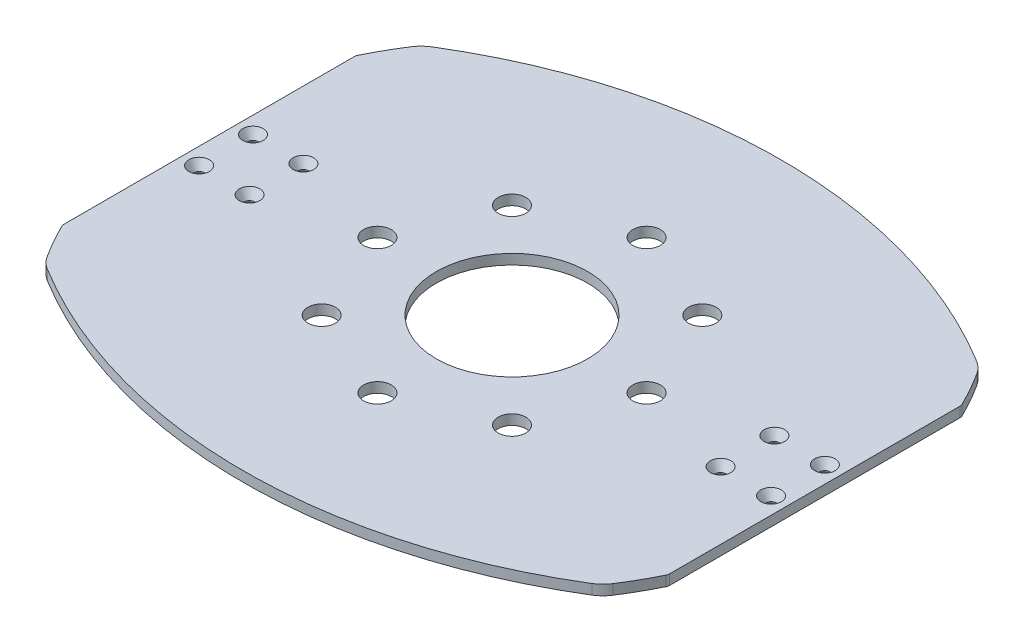
from build123d import *

# Parameters (mm, degrees)
SKETCH_2_W          = 180
SKETCH_2_H          = 180
EXTRUDE_1_DEPTH     = 3
SKETCH_3_R          = 4.1
CUT_EXTRUDE_1_DEPTH = 3
SKETCH_4_OUTSIDE_W  = 232.916
SKETCH_4_OUTSIDE_H  = 232.916
SKETCH_4_OUTSIDE_R  = 100
CUT_EXTRUDE_2_DEPTH = 3
SKETCH_5_R          = 1.55
CUT_EXTRUDE_3_DEPTH = 3
FILLET_1_R          = 2
SKETCH_7_R          = 22.5
CUT_EXTRUDE_4_DEPTH = 10
CUT_EXTRUDE_5_DEPTH = 10
FILLET_2_R          = 10
CHAMFER_1_SIZE      = 1.5
CHAMFER_1_SIZE2     = 2.598076211


with BuildPart() as part:
    # 草图2 → 凸台-拉伸1 (new body)
    with BuildSketch(Plane(origin=(0, 0, 0), x_dir=(1, 0, 0), z_dir=(0, 1, 0))):
        Rectangle(SKETCH_2_W, SKETCH_2_H)
    extrude(amount=EXTRUDE_1_DEPTH)

    # 草图3 → 切除-拉伸1 (cut)
    with BuildSketch(Plane(origin=(0, 3, 0), x_dir=(1, 0, 0), z_dir=(0, 1, 0))):
        with Locations(Location((0, 40, 0), (0, 0, 270))):
            Circle(SKETCH_3_R)
        with Locations(Location((28.284271247, 28.284271247, 0), (0, 0, 270))):
            Circle(SKETCH_3_R)
        with Locations(Location((40, 0, 0), (0, 0, 270))):
            Circle(SKETCH_3_R)
        with Locations(Location((28.284271247, -28.284271247, 0), (0, 0, 270))):
            Circle(SKETCH_3_R)
        with Locations(Location((0, -40, 0), (0, 0, 270))):
            Circle(SKETCH_3_R)
        with Locations(Location((-28.284271247, -28.284271247, 0), (0, 0, 270))):
            Circle(SKETCH_3_R)
        with Locations(Location((-40, 0, 0), (0, 0, 270))):
            Circle(SKETCH_3_R)
        with Locations(Location((-28.284271247, 28.284271247, 0), (0, 0, 270))):
            Circle(SKETCH_3_R)
    extrude(amount=-CUT_EXTRUDE_1_DEPTH, mode=Mode.SUBTRACT)

    # 草图4 outside → 切除-拉伸2 (cut)
    with BuildSketch(Plane(origin=(0, 3, 0), x_dir=(1, 0, 0), z_dir=(0, 1, 0))):
        Rectangle(SKETCH_4_OUTSIDE_W, SKETCH_4_OUTSIDE_H)
        Circle(SKETCH_4_OUTSIDE_R, mode=Mode.SUBTRACT)
    extrude(amount=-CUT_EXTRUDE_2_DEPTH, mode=Mode.SUBTRACT)

    # 草图5 → 切除-拉伸3 (cut)
    with BuildSketch(Plane(origin=(0, 3, 0), x_dir=(1, 0, 0), z_dir=(0, 1, 0))):
        with Locations(Location((-85, 8, 0), (0, 0, 270))):
            Circle(SKETCH_5_R)
        with Locations(Location((-70, 8, 0), (0, 0, 270))):
            Circle(SKETCH_5_R)
        with Locations(Location((-85, -8, 0), (0, 0, 270))):
            Circle(SKETCH_5_R)
        with Locations(Location((-70, -8, 0), (0, 0, 270))):
            Circle(SKETCH_5_R)
        with Locations(Location((70, -8, 0), (0, 0, 90))):
            Circle(SKETCH_5_R)
        with Locations(Location((85, -8, 0), (0, 0, 90))):
            Circle(SKETCH_5_R)
        with Locations(Location((70, 8, 0), (0, 0, 90))):
            Circle(SKETCH_5_R)
        with Locations(Location((85, 8, 0), (0, 0, 90))):
            Circle(SKETCH_5_R)
    extrude(amount=-CUT_EXTRUDE_3_DEPTH, mode=Mode.SUBTRACT)

    # 圆角1
    fillet_1_edges = [part.edges().sort_by_distance(p)[0] for p in [
        (-90, 1.5, -43.588989435),
        (-90, 1.5, 43.588989435),
        (-43.588989435, 1.5, 90),
        (43.588989435, 1.5, 90),
        (90, 1.5, 43.588989435),
        (90, 1.5, -43.588989435),
        (43.588989435, 1.5, -90),
        (-43.588989435, 1.5, -90),
    ]]
    fillet(fillet_1_edges, radius=FILLET_1_R)

    # 草图7 → 切除-拉伸4 (cut)
    with BuildSketch(Plane(origin=(0, 3, 0), x_dir=(1, 0, 0), z_dir=(0, 1, 0))):
        with Locations(Location((0, 0, 0), (0, 0, 270))):
            Circle(SKETCH_7_R)
    extrude(amount=-CUT_EXTRUDE_4_DEPTH, mode=Mode.SUBTRACT)

    # 草图8 → 切除-拉伸5 (cut)
    with BuildSketch(Plane(origin=(0, 3, 0), x_dir=(1, 0, 0), z_dir=(0, 1, 0))):
        with BuildLine():
            ThreePointArc((44.007874802, 89.795918367), (43.579471257, 89.948311671), (43.127717306, 90))
            Line((43.127717306, 90), (-43.127717306, 90))
            ThreePointArc((-43.127717306, 90), (-43.579471257, 89.948311671), (-44.007874802, 89.795918367))
            ThreePointArc((-44.007874802, 89.795918367), (-65.640873182, 75.440544589), (-82.849260709, 56))
            ThreePointArc((-82.849260709, 56), (0, 80), (82.849260709, 56))
            ThreePointArc((82.849260709, 56), (65.640873182, 75.440544589), (44.007874802, 89.795918367))
        make_face()
        with BuildLine():
            ThreePointArc((-44.007874802, -89.795918367), (-43.579471257, -89.948311671), (-43.127717306, -90))
            Line((-43.127717306, -90), (43.127717306, -90))
            ThreePointArc((43.127717306, -90), (43.579471257, -89.948311671), (44.007874802, -89.795918367))
            ThreePointArc((44.007874802, -89.795918367), (65.640873182, -75.440544589), (82.849260709, -56))
            ThreePointArc((82.849260709, -56), (0, -80), (-82.849260709, -56))
            ThreePointArc((-82.849260709, -56), (-65.640873182, -75.440544589), (-44.007874802, -89.795918367))
        make_face()
    extrude(amount=-CUT_EXTRUDE_5_DEPTH, mode=Mode.SUBTRACT)

    # 圆角2
    fillet_2_edges = [part.edges().sort_by_distance(p)[0] for p in [
        (82.849260709, 1.5, -56),
        (-82.849260709, 1.5, -56),
        (-82.849260709, 1.5, 56),
        (82.849260709, 1.5, 56),
    ]]
    fillet(fillet_2_edges, radius=FILLET_2_R)

    # 倒角1
    chamfer_1_edges = [part.edges().sort_by_distance(p)[0] for p in [
        (70, 3, 9.55),
        (-70, 3, 6.45),
        (-85, 3, 6.45),
        (-70, 3, -9.55),
        (85, 3, -6.45),
        (70, 3, -6.45),
        (85, 3, 9.55),
        (-85, 3, -9.55),
    ]]
    chamfer_1_side = [part.faces().sort_by_distance(p)[0] for p in [
        (-85.005243711, 3, -47.940012077),
    ]]
    chamfer(chamfer_1_edges, length=CHAMFER_1_SIZE, length2=CHAMFER_1_SIZE2, reference=chamfer_1_side[0])


solid = part.part
